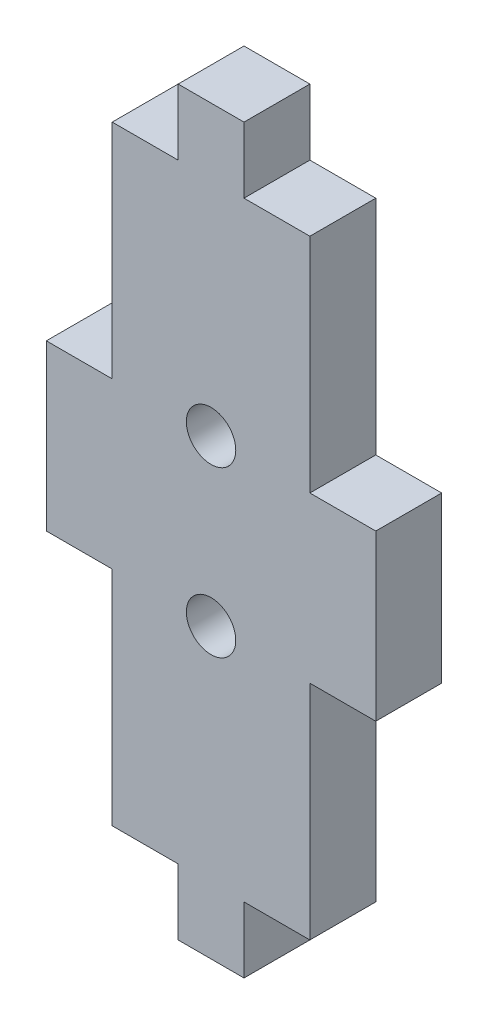
from build123d import *

# Parameters (mm, degrees)
SKETCH_1_R      = 1.5
EXTRUDE_1_DEPTH = 4


with BuildPart() as part:
    # Эскиз1 → Бобышка-Вытянуть1 (new body)
    with BuildSketch(Plane.XY):
        Polygon((0, 0), (4, 0), (4, -4), (8, -4), (8, 0), (12, 0), (12, 13.5), (16, 13.5), (16, 23.5), (12, 23.5), (12, 37), (8, 37), (8, 41), (4, 41), (4, 37), (0, 37), (0, 23.5), (-4, 23.5), (-4, 13.5), (0, 13.5), align=None)
        with Locations((6, 23.5)):
            Circle(SKETCH_1_R, mode=Mode.SUBTRACT)
        with Locations(Location((6, 13.5, 0), (0, 0, 180))):
            Circle(SKETCH_1_R, mode=Mode.SUBTRACT)
    extrude(amount=EXTRUDE_1_DEPTH)


solid = part.part
